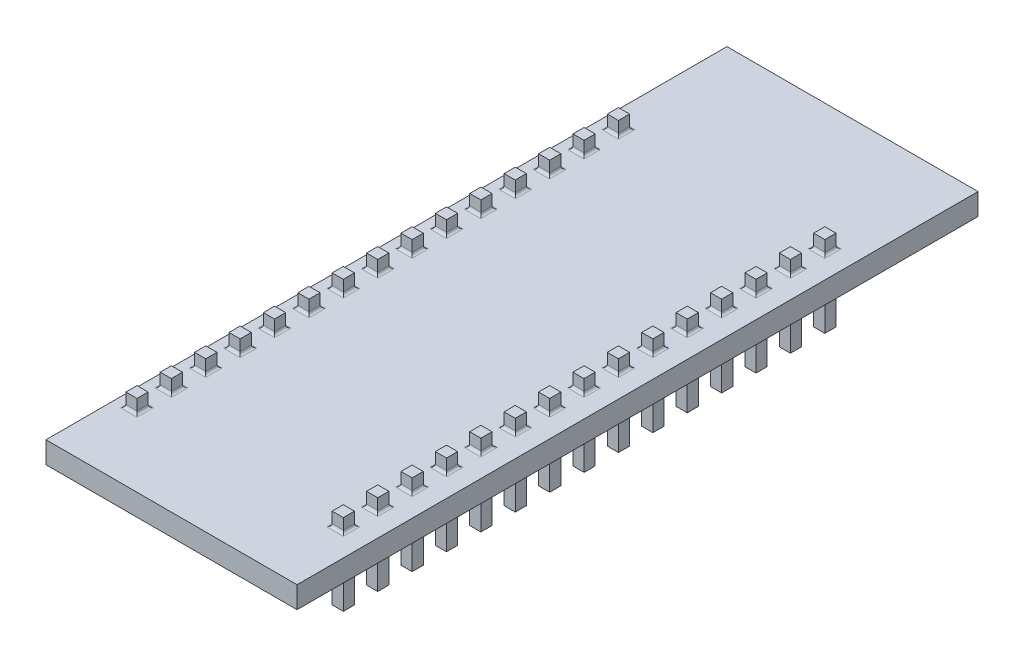
from build123d import *

# Parameters (mm, degrees)
SKETCH1_W              = 18.54
SKETCH1_H              = 50.29
BOSS_EXTRUDE1_DEPTH    = 1.6
BOSS_EXTRUDE2_START    = -5
SKETCH2_W              = 0.824083908
SKETCH2_H              = 0.824083908
BOSS_EXTRUDE2_DEPTH    = 6
FILLET1_R              = 0.2
LPATTERN1_COUNT        = 15
LPATTERN1_PITCH        = 2.54
LPATTERN1_COUNT_DIR2   = 2
LPATTERN1_PITCH_DIR2   = 15.24
FILLET1_OF_LPATTERN1_R = 0.2


with BuildPart() as part:
    # Sketch1 → Boss-Extrude1 (new body)
    with BuildSketch(Plane(origin=(0, 0, 0), x_dir=(1, 0, 0), z_dir=(0, 1, 0))):
        with Locations((2.849385246, -17.413668033)):
            Rectangle(SKETCH1_W, SKETCH1_H)
    extrude(amount=BOSS_EXTRUDE1_DEPTH)

    # Sketch2 → Boss-Extrude2 (add)
    with BuildSketch(Plane(origin=(0, 1.6, 0), x_dir=(1, 0, 0), z_dir=(0, 1, 0)).offset(BOSS_EXTRUDE2_START)):
        with Locations((-5.115363746, -37.146626079)):
            Rectangle(SKETCH2_W, SKETCH2_H)
    boss_extrude2 = extrude(amount=BOSS_EXTRUDE2_DEPTH)

    # Fillet1
    fillet1_edges = [part.edges().sort_by_distance(p)[0] for p in [
        (-5.5274057, 1.6, 37.146626079),
        (-5.115363746, 1.6, 36.734584125),
        (-4.703321792, 1.6, 37.146626079),
        (-5.115363746, 1.6, 37.558668033),
    ]]
    fillet(fillet1_edges, radius=FILLET1_R)

    # LPattern1: Boss-Extrude2 15 × 2
    with Locations(*[(j * LPATTERN1_PITCH_DIR2, 0, -i * LPATTERN1_PITCH) for i in range(LPATTERN1_COUNT) for j in range(LPATTERN1_COUNT_DIR2) if (i, j) != (0, 0)]):
        add(boss_extrude2)

    # Fillet1 of LPattern1
    fillet1_of_lpattern1_edges = [part.edges().sort_by_distance(p)[0] for p in [
        (9.7125943, 1.6, 37.146626079),
        (10.124636254, 1.6, 36.734584125),
        (10.536678208, 1.6, 37.146626079),
        (10.124636254, 1.6, 37.558668033),
        (-5.5274057, 1.6, 34.606626079),
        (-5.115363746, 1.6, 34.194584125),
        (-4.703321792, 1.6, 34.606626079),
        (-5.115363746, 1.6, 35.018668033),
        (9.7125943, 1.6, 34.606626079),
        (10.124636254, 1.6, 34.194584125),
        (10.536678208, 1.6, 34.606626079),
        (10.124636254, 1.6, 35.018668033),
        (-5.5274057, 1.6, 32.066626079),
        (-5.115363746, 1.6, 31.654584125),
        (-4.703321792, 1.6, 32.066626079),
        (-5.115363746, 1.6, 32.478668033),
        (9.7125943, 1.6, 32.066626079),
        (10.124636254, 1.6, 31.654584125),
        (10.536678208, 1.6, 32.066626079),
        (10.124636254, 1.6, 32.478668033),
        (-5.5274057, 1.6, 29.526626079),
        (-5.115363746, 1.6, 29.114584125),
        (-4.703321792, 1.6, 29.526626079),
        (-5.115363746, 1.6, 29.938668033),
        (9.7125943, 1.6, 29.526626079),
        (10.124636254, 1.6, 29.114584125),
        (10.536678208, 1.6, 29.526626079),
        (10.124636254, 1.6, 29.938668033),
        (-5.5274057, 1.6, 26.986626079),
        (-5.115363746, 1.6, 26.574584125),
        (-4.703321792, 1.6, 26.986626079),
        (-5.115363746, 1.6, 27.398668033),
        (9.7125943, 1.6, 26.986626079),
        (10.124636254, 1.6, 26.574584125),
        (10.536678208, 1.6, 26.986626079),
        (10.124636254, 1.6, 27.398668033),
        (-5.5274057, 1.6, 24.446626079),
        (-5.115363746, 1.6, 24.034584125),
        (-4.703321792, 1.6, 24.446626079),
        (-5.115363746, 1.6, 24.858668033),
        (9.7125943, 1.6, 24.446626079),
        (10.124636254, 1.6, 24.034584125),
        (10.536678208, 1.6, 24.446626079),
        (10.124636254, 1.6, 24.858668033),
        (-5.5274057, 1.6, 21.906626079),
        (-5.115363746, 1.6, 21.494584125),
        (-4.703321792, 1.6, 21.906626079),
        (-5.115363746, 1.6, 22.318668033),
        (9.7125943, 1.6, 21.906626079),
        (10.124636254, 1.6, 21.494584125),
        (10.536678208, 1.6, 21.906626079),
        (10.124636254, 1.6, 22.318668033),
        (-5.5274057, 1.6, 19.366626079),
        (-5.115363746, 1.6, 18.954584125),
        (-4.703321792, 1.6, 19.366626079),
        (-5.115363746, 1.6, 19.778668033),
        (9.7125943, 1.6, 19.366626079),
        (10.124636254, 1.6, 18.954584125),
        (10.536678208, 1.6, 19.366626079),
        (10.124636254, 1.6, 19.778668033),
        (-5.5274057, 1.6, 16.826626079),
        (-5.115363746, 1.6, 16.414584125),
        (-4.703321792, 1.6, 16.826626079),
        (-5.115363746, 1.6, 17.238668033),
        (9.7125943, 1.6, 16.826626079),
        (10.124636254, 1.6, 16.414584125),
        (10.536678208, 1.6, 16.826626079),
        (10.124636254, 1.6, 17.238668033),
        (-5.5274057, 1.6, 14.286626079),
        (-5.115363746, 1.6, 13.874584125),
        (-4.703321792, 1.6, 14.286626079),
        (-5.115363746, 1.6, 14.698668033),
        (9.7125943, 1.6, 14.286626079),
        (10.124636254, 1.6, 13.874584125),
        (10.536678208, 1.6, 14.286626079),
        (10.124636254, 1.6, 14.698668033),
        (-5.5274057, 1.6, 11.746626079),
        (-5.115363746, 1.6, 11.334584125),
        (-4.703321792, 1.6, 11.746626079),
        (-5.115363746, 1.6, 12.158668033),
        (9.7125943, 1.6, 11.746626079),
        (10.124636254, 1.6, 11.334584125),
        (10.536678208, 1.6, 11.746626079),
        (10.124636254, 1.6, 12.158668033),
        (-5.5274057, 1.6, 9.206626079),
        (-5.115363746, 1.6, 8.794584125),
        (-4.703321792, 1.6, 9.206626079),
        (-5.115363746, 1.6, 9.618668033),
        (9.7125943, 1.6, 9.206626079),
        (10.124636254, 1.6, 8.794584125),
        (10.536678208, 1.6, 9.206626079),
        (10.124636254, 1.6, 9.618668033),
        (-5.5274057, 1.6, 6.666626079),
        (-5.115363746, 1.6, 6.254584125),
        (-4.703321792, 1.6, 6.666626079),
        (-5.115363746, 1.6, 7.078668033),
        (9.7125943, 1.6, 6.666626079),
        (10.124636254, 1.6, 6.254584125),
        (10.536678208, 1.6, 6.666626079),
        (10.124636254, 1.6, 7.078668033),
        (-5.5274057, 1.6, 4.126626079),
        (-5.115363746, 1.6, 3.714584125),
        (-4.703321792, 1.6, 4.126626079),
        (-5.115363746, 1.6, 4.538668033),
        (9.7125943, 1.6, 4.126626079),
        (10.124636254, 1.6, 3.714584125),
        (10.536678208, 1.6, 4.126626079),
        (10.124636254, 1.6, 4.538668033),
        (-5.5274057, 1.6, 1.586626079),
        (-5.115363746, 1.6, 1.174584125),
        (-4.703321792, 1.6, 1.586626079),
        (-5.115363746, 1.6, 1.998668033),
        (9.7125943, 1.6, 1.586626079),
        (10.124636254, 1.6, 1.174584125),
        (10.536678208, 1.6, 1.586626079),
        (10.124636254, 1.6, 1.998668033),
    ]]
    fillet(fillet1_of_lpattern1_edges, radius=FILLET1_OF_LPATTERN1_R)


solid = part.part
